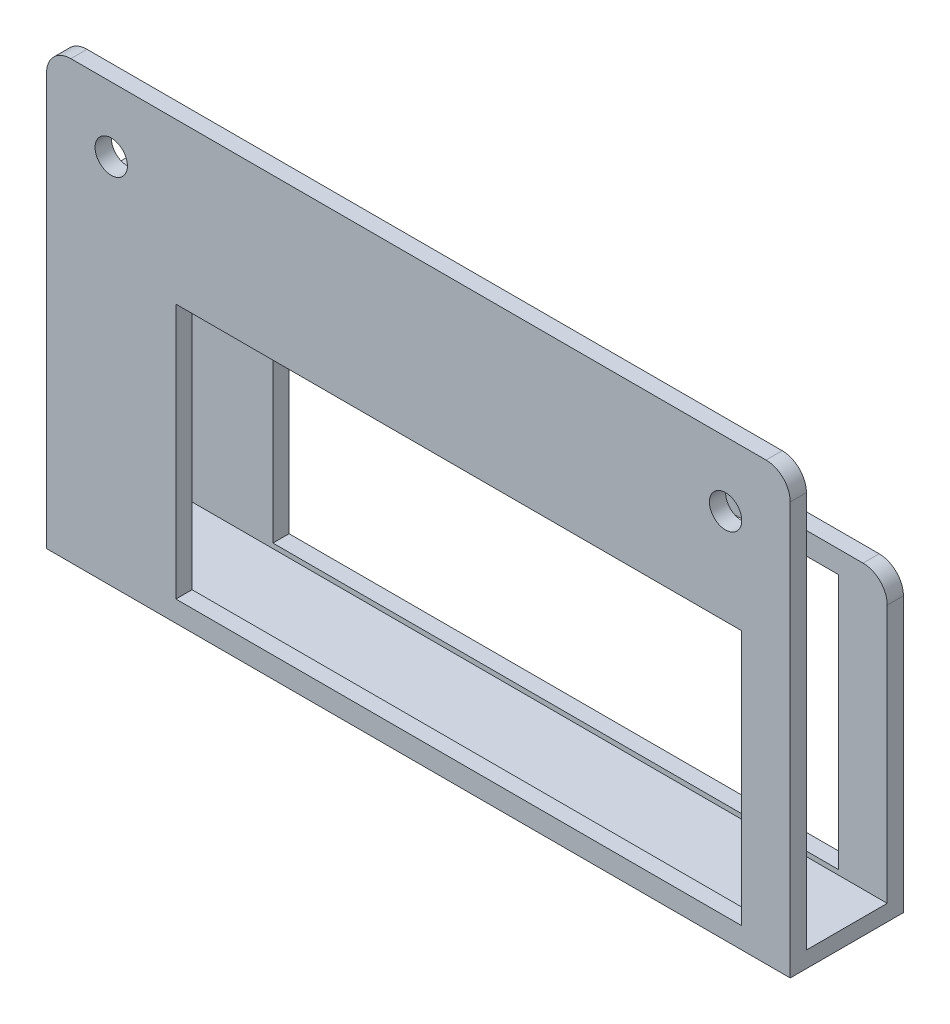
from build123d import *

# Parameters (mm, degrees)
CROQUIS1_W              = 92
CROQUIS1_H              = 54
CROQUIS1_R              = 2
CROQUIS1_W_2            = 70
CROQUIS1_H_2            = 31.6
SALIENTE_EXTRUIR1_DEPTH = 14
CORTAR_EXTRUIR1_DEPTH   = 90
CROQUIS3_W              = 2
CROQUIS3_H              = 17.046925302
CORTAR_EXTRUIR2_DEPTH   = 12
CROQUIS4_W              = 8
CROQUIS4_H              = 13
CORTAR_EXTRUIR3_DEPTH   = 2
REDONDEO1_R             = 3
REDONDEO2_R             = 3
REDONDEO3_R             = 3


with BuildPart() as part:
    # Croquis1 → Saliente-Extruir1 (new body)
    with BuildSketch(Plane.XY):
        with Locations((-46, 27)):
            Rectangle(CROQUIS1_W, CROQUIS1_H)
        with Locations((-84, 46)):
            Circle(CROQUIS1_R, mode=Mode.SUBTRACT)
        with Locations((-8, 46)):
            Circle(CROQUIS1_R, mode=Mode.SUBTRACT)
        with Locations((-41, 18.4)):
            Rectangle(CROQUIS1_W_2, CROQUIS1_H_2, mode=Mode.SUBTRACT)
    extrude(amount=SALIENTE_EXTRUIR1_DEPTH)

    # Croquis2 → Cortar-Extruir1 (cut)
    with BuildSketch(Plane(origin=(0, 0, 0), x_dir=(0, 0, -1), z_dir=(1, 0, 0))):
        Polygon((-2, 36.953074698), (-2, 2), (-12, 2), (-12, 36.953074698), (-12, 54), (-2, 54), (0, 54), (0, 36.953074698), align=None)
    extrude(amount=-CORTAR_EXTRUIR1_DEPTH, mode=Mode.SUBTRACT)

    # Croquis3 → Cortar-Extruir2 (cut)
    with BuildSketch(Plane(origin=(0, 0, 0), x_dir=(-1, 0, 0), z_dir=(0, 0, -1))):
        with Locations((91, 45.476537349)):
            Rectangle(CROQUIS3_W, CROQUIS3_H)
    extrude(amount=-CORTAR_EXTRUIR2_DEPTH, mode=Mode.SUBTRACT)

    # Croquis4 → Cortar-Extruir3 (cut)
    with BuildSketch(Plane.ZY.offset(92)):
        with Locations((7, 8.840884816)):
            Rectangle(CROQUIS4_W, CROQUIS4_H)
    extrude(amount=-CORTAR_EXTRUIR3_DEPTH, mode=Mode.SUBTRACT)

    # Redondeo1
    redondeo1_edges = [part.edges().sort_by_distance(p)[0] for p in [
        (-92, 54, 13),
    ]]
    fillet(redondeo1_edges, radius=REDONDEO1_R)

    # Redondeo2
    redondeo2_edges = [part.edges().sort_by_distance(p)[0] for p in [
        (0, 54, 13),
    ]]
    fillet(redondeo2_edges, radius=REDONDEO2_R)

    # Redondeo3
    redondeo3_edges = [part.edges().sort_by_distance(p)[0] for p in [
        (0, 36.953074698, 1),
    ]]
    fillet(redondeo3_edges, radius=REDONDEO3_R)


solid = part.part
